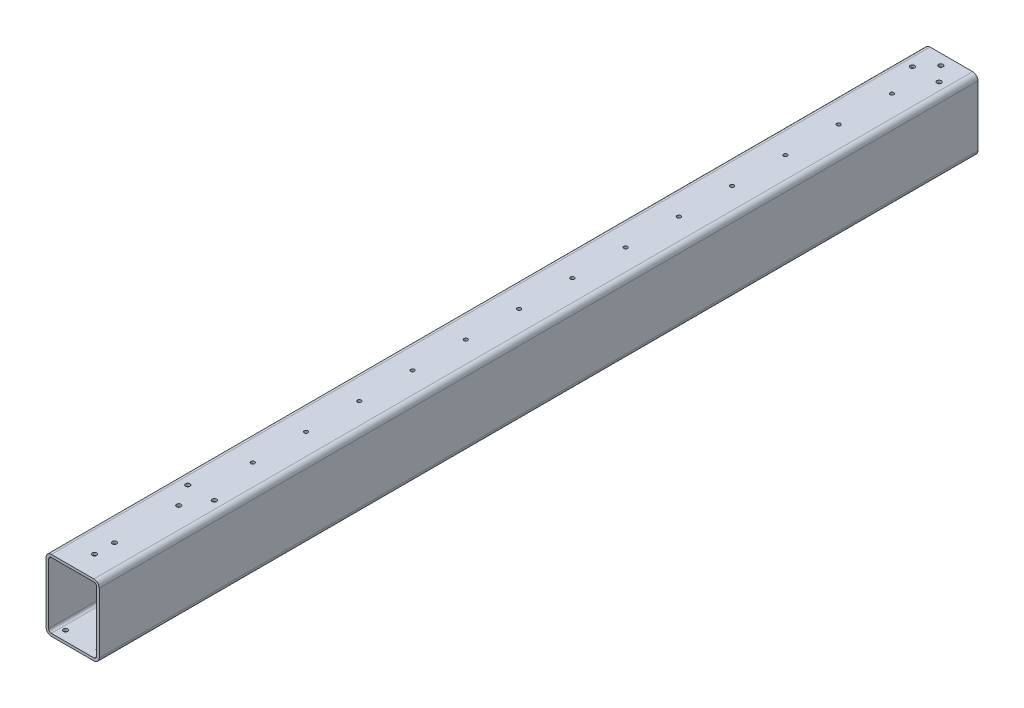
from build123d import *

# Parameters (mm, degrees)
BOSS_EXTRUDE1_DEPTH             = 990
TAP_DRILL_FOR_M6X1_0_TAP1_D     = 5
TAP_DRILL_FOR_M6X1_0_TAP1_DEPTH = 10
TAP_DRILL_FOR_M6X1_0_TAP1_TIP   = 1.502151548
TAP_DRILL_FOR_M5X0_8_TAP1_D     = 4.2
TAP_DRILL_FOR_M5X0_8_TAP1_DEPTH = 3
TAP_DRILL_FOR_M6X1_0_TAP2_D     = 5
TAP_DRILL_FOR_M6X1_0_TAP2_DEPTH = 3


with BuildPart() as part:
    # Sketch1 → Boss-Extrude1 (new body)
    with BuildSketch(Plane.XY):
        with BuildLine():
            Line((-30, -34), (-30, 34))
            ThreePointArc((-30, 34), (-28.242640687, 38.242640687), (-24, 40))
            Line((-24, 40), (24, 40))
            ThreePointArc((24, 40), (28.242640687, 38.242640687), (30, 34))
            Line((30, 34), (30, -34))
            ThreePointArc((30, -34), (28.242640687, -38.242640687), (24, -40))
            Line((24, -40), (-24, -40))
            ThreePointArc((-24, -40), (-28.242640687, -38.242640687), (-30, -34))
        make_face()
        with BuildLine():
            Line((-27, -34), (-27, 34))
            ThreePointArc((-27, 34), (-26.121320344, 36.121320344), (-24, 37))
            Line((-24, 37), (24, 37))
            ThreePointArc((24, 37), (26.121320344, 36.121320344), (27, 34))
            Line((27, 34), (27, -34))
            ThreePointArc((27, -34), (26.121320344, -36.121320344), (24, -37))
            Line((24, -37), (-24, -37))
            ThreePointArc((-24, -37), (-26.121320344, -36.121320344), (-27, -34))
        make_face(mode=Mode.SUBTRACT)
    extrude(amount=BOSS_EXTRUDE1_DEPTH)

    # Tap Drill for M6x1.0 Tap1
    with Locations(Plane(origin=(19, -40, 979), x_dir=(0, 0, -1), z_dir=(0, -1, 0))):
        with Locations((0, 0), (0, -38), (58, -38), (58, 0), (455, 0), (455, -38), (513, 0), (513, -38), (910, 0), (968, 0), (968, -38), (910, -38)):
            Hole(TAP_DRILL_FOR_M6X1_0_TAP1_D / 2, depth=TAP_DRILL_FOR_M6X1_0_TAP1_DEPTH)
            with Locations((0, 0, -(TAP_DRILL_FOR_M6X1_0_TAP1_DEPTH + TAP_DRILL_FOR_M6X1_0_TAP1_TIP / 2))):  # 118° drill point
                Cone(0, TAP_DRILL_FOR_M6X1_0_TAP1_D / 2, TAP_DRILL_FOR_M6X1_0_TAP1_TIP, mode=Mode.SUBTRACT)

    # Tap Drill for M5x0.8 Tap1
    with Locations(Plane(origin=(-0.018233765, 40, 787), x_dir=(0, 0, 1), z_dir=(0, 1, 0))):
        with Locations((0, 0), (-60, 0), (-120, 0), (-180, 0), (-240, 0), (-300, 0), (-360, 0), (-420, 0), (-480, 0), (-540, 0), (-600, 0), (-660, 0), (-720, 0)):
            Hole(TAP_DRILL_FOR_M5X0_8_TAP1_D / 2, depth=TAP_DRILL_FOR_M5X0_8_TAP1_DEPTH)

    # Tap Drill for M6x1.0 Tap2
    with Locations(Plane(origin=(0.15, 40, 965.5), x_dir=(0, 0, 1), z_dir=(0, 1, 0))):
        with Locations((0, 0), (-22.5, 0), (-95, 0), (-120, -15), (-120, 15), (-936.5, 15), (-953.5, 0), (-936.5, -15)):
            Hole(TAP_DRILL_FOR_M6X1_0_TAP2_D / 2, depth=TAP_DRILL_FOR_M6X1_0_TAP2_DEPTH)


solid = part.part
